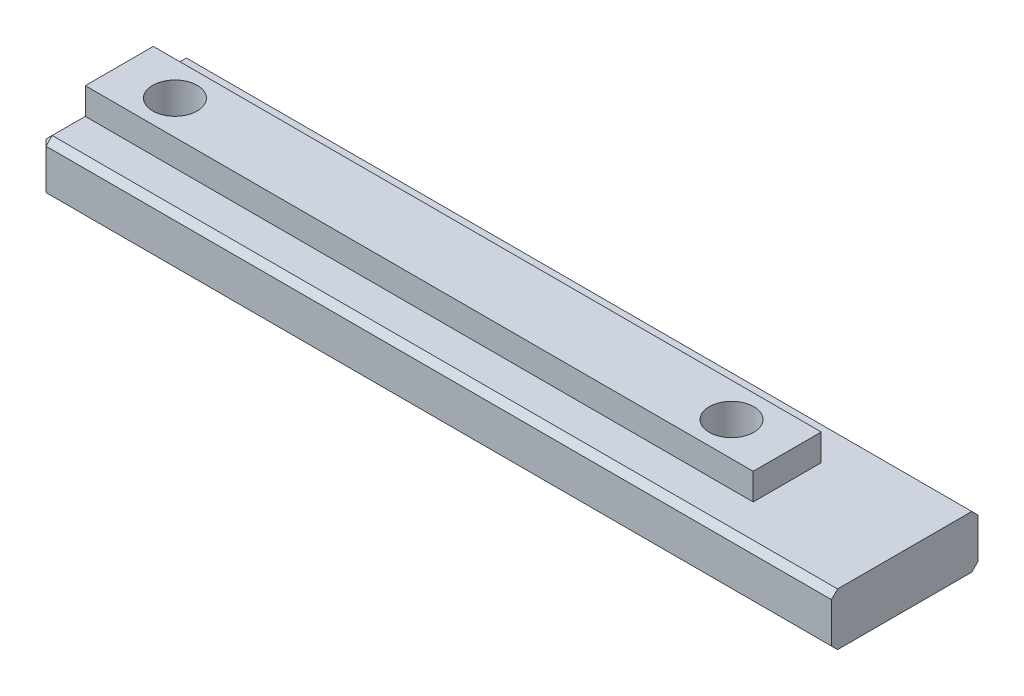
from build123d import *

# Parameters (mm, degrees)
SKETCH1_W                     = 55
SKETCH1_H                     = 11.85
BOSS_EXTRUDE1_DEPTH           = 4.25
CHAMFER1_SIZE                 = 0.5
BOSS_EXTRUDE2_DEPTH           = 27
BOSS_EXTRUDE2_DEPTH_BACK      = 27
SKETCH7_W                     = 5.5
SKETCH7_H                     = 2.15
CBORE_FOR_M3_SHCS1_AT_2_COUNT = 2
CBORE_FOR_M3_SHCS1_AT_2_PITCH = 45
BOSS_EXTRUDE3_DEPTH           = 9
CUT_EXTRUDE1_DEPTH            = 2
CUT_EXTRUDE1_DEPTH_BACK       = 2
SKETCH10_W                    = 3.3
SKETCH10_H                    = 2.5


with BuildPart() as part:
    # Sketch1 → Boss-Extrude1 (new body)
    with BuildSketch(Plane(origin=(0, 0, 0), x_dir=(1, 0, 0), z_dir=(0, 1, 0))):
        Rectangle(SKETCH1_W, SKETCH1_H)
    extrude(amount=BOSS_EXTRUDE1_DEPTH)

    # Chamfer1
    chamfer1_edges = [part.edges().sort_by_distance(p)[0] for p in [
        (-27.5, 4.25, 0),
        (0, 4.25, 5.925),
        (0, 0, 5.925),
        (-27.5, 0, 0),
        (0, 0, -5.925),
        (-27.5, 2.125, 5.925),
        (-27.5, 2.125, -5.925),
        (0, 4.25, -5.925),
    ]]
    chamfer(chamfer1_edges, length=CHAMFER1_SIZE)

    # Sketch7 → Boss-Extrude2 (add, two sides: drawn at the far end of the back side and taken through both)
    with BuildSketch(Plane(origin=(0, 0, 0), x_dir=(0, 0, -1), z_dir=(1, 0, 0)).offset(-BOSS_EXTRUDE2_DEPTH_BACK)):
        with Locations((0, 5.325)):
            Rectangle(SKETCH7_W, SKETCH7_H)
    extrude(amount=BOSS_EXTRUDE2_DEPTH + BOSS_EXTRUDE2_DEPTH_BACK)

    # Sketch6 → CBORE for M3 SHCS1 (revolve, cut)
    with BuildSketch(Plane(origin=(22.5, 0, 0), x_dir=(0, 0, -1), z_dir=(1, 0, 0))):
        Polygon((0, 0), (0, 6.4), (1.8, 6.4), (1.8, 2.2), (3.25, 2.2), (3.25, 0.025), (3.275, 0), align=None)
    cbore_for_m3_shcs1 = revolve(axis=Axis((22.5, -6.35, 0), (0, 1, 0)), mode=Mode.SUBTRACT)

    # CBORE for M3 SHCS1 at 2: CBORE for M3 SHCS1 ×2
    with Locations(*[(-i * CBORE_FOR_M3_SHCS1_AT_2_PITCH, 0, 0) for i in range(1, CBORE_FOR_M3_SHCS1_AT_2_COUNT)]):
        add(cbore_for_m3_shcs1, mode=Mode.SUBTRACT)

    # Sketch8 → Boss-Extrude3 (add)
    with BuildSketch(Plane(origin=(27.5, 0, 0), x_dir=(0, 0, -1), z_dir=(1, 0, 0))):
        Polygon((5.425, 4.25), (-5.425, 4.25), (-5.925, 3.75), (-5.925, 0.5), (-5.425, 0), (5.425, 0), (5.925, 0.5), (5.925, 3.75), align=None)
    extrude(amount=BOSS_EXTRUDE3_DEPTH)

    # Sketch10 → Cut-Extrude1 (cut, two sides: drawn at the far end of the back side and taken through both)
    with BuildSketch(Plane.XY.offset(-CUT_EXTRUDE1_DEPTH_BACK)):
        with Locations((32.8, 1.25)):
            Rectangle(SKETCH10_W, SKETCH10_H)
    extrude(amount=CUT_EXTRUDE1_DEPTH + CUT_EXTRUDE1_DEPTH_BACK, mode=Mode.SUBTRACT)


solid = part.part
